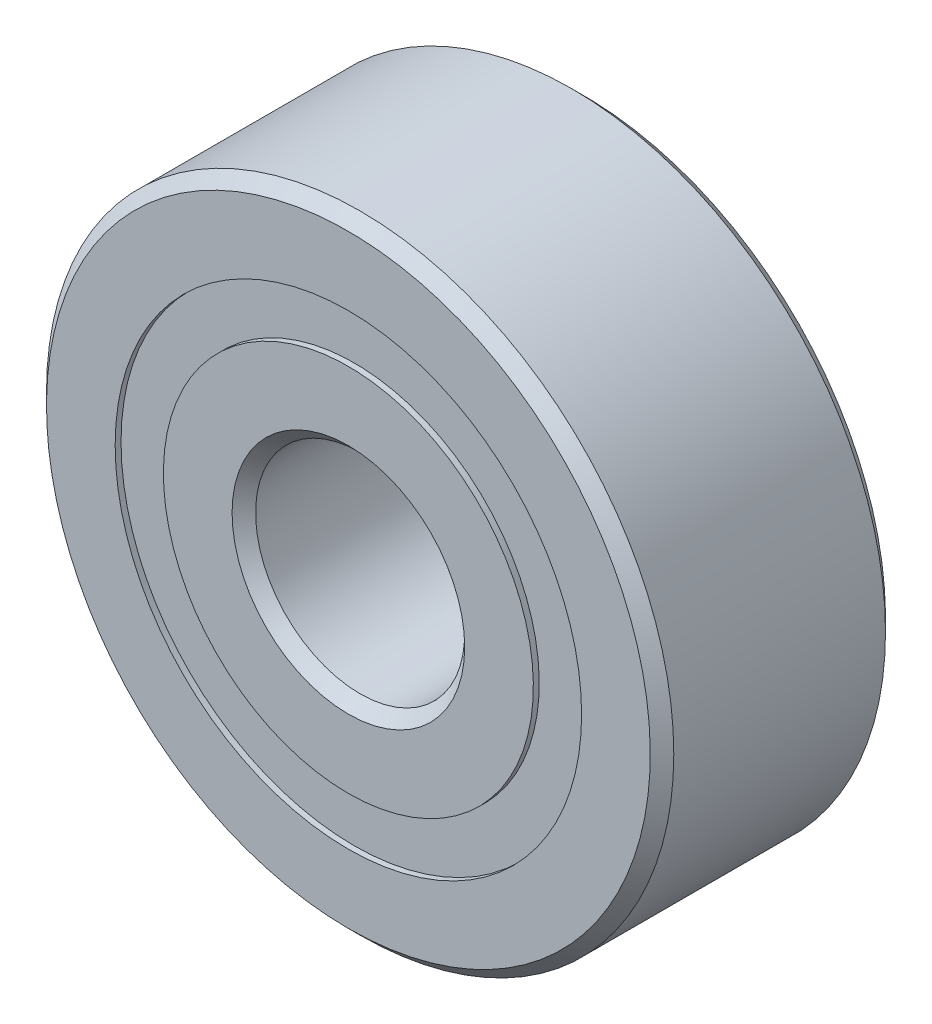
from build123d import *

# Parameters (mm, degrees)
CIRPATTERN1_COUNT = 8
SKETCH5_W         = 1.644855024
SKETCH5_H         = 1.465384616


with BuildPart() as part:
    # Sketch7 → Revolve6 (revolve)
    with BuildSketch(Plane(origin=(0, 0, 0), x_dir=(0, 0, -1), z_dir=(1, 0, 0)), mode=Mode.PRIVATE) as revolve6_sk:
        with BuildLine():
            Line((3.2146875, 9.525), (3.571875, 9.1678125))
            Line((3.571875, 9.1678125), (3.571875, 7.082692308))
            Line((3.571875, 7.082692308), (1.5875, 7.082692308))
            ThreePointArc((1.5875, 7.082692308), (0, 8.098426226), (-1.5875, 7.082692308))
            Line((-1.5875, 7.082692308), (-3.571875, 7.082692308))
            Line((-3.571875, 7.082692308), (-3.571875, 9.1678125))
            Line((-3.571875, 9.1678125), (-3.2146875, 9.525))
            Line((-3.2146875, 9.525), (3.2146875, 9.525))
        make_face()
    revolve(revolve6_sk.sketch.rotate(Axis((0, 0, 3.571875), (0, 0, -1)), 180), axis=Axis((0, 0, 3.571875), (0, 0, -1)))


with BuildPart() as body_2:
    # Sketch3 → Revolve3 (revolve)
    with BuildSketch(Plane(origin=(0, 0, 0), x_dir=(0, 0, -1), z_dir=(1, 0, 0)), mode=Mode.PRIVATE) as revolve3_sk:
        with BuildLine():
            Line((-3.2146875, 3.175), (-3.571875, 3.5321875))
            Line((-3.571875, 3.5321875), (-3.571875, 5.617307692))
            Line((-3.571875, 5.617307692), (-1.5875, 5.617307692))
            ThreePointArc((-1.5875, 5.617307692), (0, 4.601573774), (1.5875, 5.617307692))
            Line((1.5875, 5.617307692), (3.571875, 5.617307692))
            Line((3.571875, 5.617307692), (3.571875, 3.5321875))
            Line((3.571875, 3.5321875), (3.2146875, 3.175))
            Line((3.2146875, 3.175), (-3.2146875, 3.175))
        make_face()
    revolve(revolve3_sk.sketch.rotate(Axis((0, 0, 3.571875), (0, 0, -1)), 180), axis=Axis((0, 0, 3.571875), (0, 0, -1)))


with BuildPart() as body_3:
    # Sketch4 → Revolve4 (revolve)
    with BuildSketch(Plane(origin=(0, 0, 0), x_dir=(0, 0, -1), z_dir=(1, 0, 0))):
        with BuildLine():
            Line((-1.748426226, 6.35), (1.748426226, 6.35))
            ThreePointArc((1.748426226, 6.35), (0, 8.098426226), (-1.748426226, 6.35))
        make_face()
    revolve(axis=Axis((0, 6.35, 1.748426226), (0, 0, -1)))


with BuildPart() as cirpattern1_1:
    # CirPattern1: pattern copy
    add(body_3.part.rotate(Axis((0, 0, 0), (0, 0, 1)), 1 * 360 / CIRPATTERN1_COUNT))


with BuildPart() as cirpattern1_2:
    # CirPattern1: pattern copy
    add(body_3.part.rotate(Axis((0, 0, 0), (0, 0, 1)), 2 * 360 / CIRPATTERN1_COUNT))


with BuildPart() as cirpattern1_3:
    # CirPattern1: pattern copy
    add(body_3.part.rotate(Axis((0, 0, 0), (0, 0, 1)), 3 * 360 / CIRPATTERN1_COUNT))


with BuildPart() as cirpattern1_4:
    # CirPattern1: pattern copy
    add(body_3.part.rotate(Axis((0, 0, 0), (0, 0, 1)), 4 * 360 / CIRPATTERN1_COUNT))


with BuildPart() as cirpattern1_5:
    # CirPattern1: pattern copy
    add(body_3.part.rotate(Axis((0, 0, 0), (0, 0, 1)), 5 * 360 / CIRPATTERN1_COUNT))


with BuildPart() as cirpattern1_6:
    # CirPattern1: pattern copy
    add(body_3.part.rotate(Axis((0, 0, 0), (0, 0, 1)), 6 * 360 / CIRPATTERN1_COUNT))


with BuildPart() as cirpattern1_7:
    # CirPattern1: pattern copy
    add(body_3.part.rotate(Axis((0, 0, 0), (0, 0, 1)), 7 * 360 / CIRPATTERN1_COUNT))


with BuildPart() as body_11:
    # Sketch5 → Revolve5 (revolve)
    with BuildSketch(Plane(origin=(0, 0, 0), x_dir=(0, 0, -1), z_dir=(1, 0, 0)), mode=Mode.PRIVATE) as revolve5_sk:
        with Locations((-2.570853738, 6.35)):
            Rectangle(SKETCH5_W, SKETCH5_H)
        with Locations((2.570853738, 6.35)):
            Rectangle(SKETCH5_W, SKETCH5_H)
    revolve(revolve5_sk.sketch.rotate(Axis((0, 0, 3.571875), (0, 0, -1)), 180), axis=Axis((0, 0, 3.571875), (0, 0, -1)))


solid = Compound([part.part, body_2.part, body_3.part, cirpattern1_1.part, cirpattern1_2.part, cirpattern1_3.part, cirpattern1_4.part, cirpattern1_5.part, cirpattern1_6.part, cirpattern1_7.part, body_11.part])
